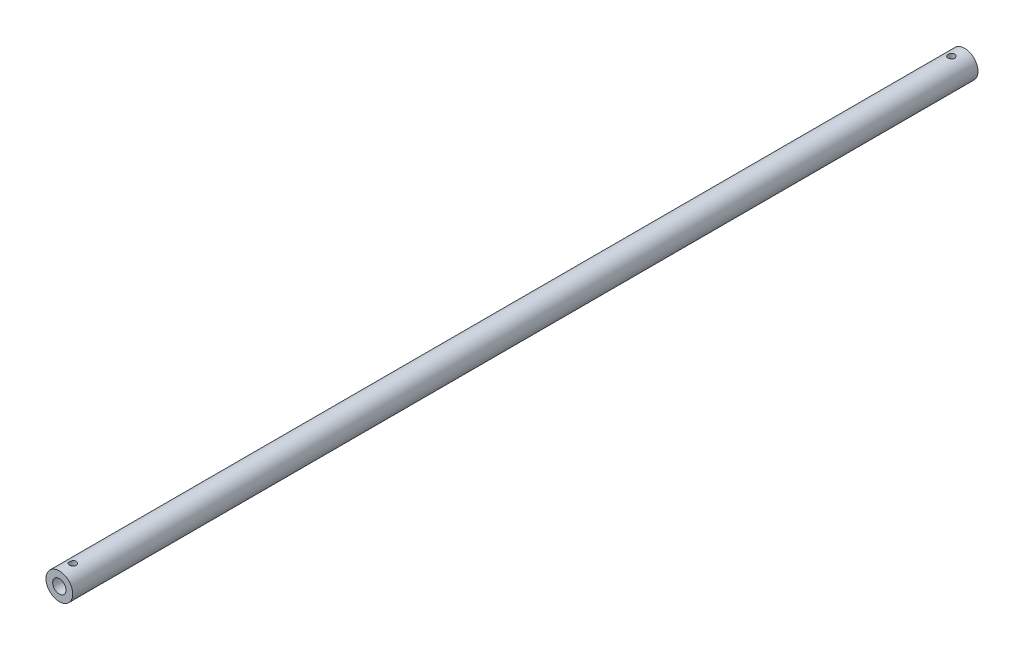
from build123d import *

# Parameters (mm, degrees)
SKETCH1_R               = 10
SKETCH1_R_2             = 5
BOSS_EXTRUDE1_DEPTH     = 338.5
CUT_EXTRUDE1_DEPTH      = 339.795292175
CUT_EXTRUDE1_DEPTH_BACK = 339.795292175
SKETCH2_R               = 2.5


with BuildPart() as part:
    # Sketch1 → Boss-Extrude1 (new, symmetric)
    with BuildSketch(Plane.XY):
        Circle(SKETCH1_R)
        Circle(SKETCH1_R_2, mode=Mode.SUBTRACT)
    extrude(amount=BOSS_EXTRUDE1_DEPTH, both=True)

    # Sketch2 → Cut-Extrude1 (cut, two sides: drawn at the far end of the back side and taken through both)
    with BuildSketch(Plane(origin=(0, 0, 0), x_dir=(1, 0, 0), z_dir=(0, 1, 0)).offset(-CUT_EXTRUDE1_DEPTH_BACK)):
        with Locations(Location((0, -328.5, 0), (0, 0, 270))):
            Circle(SKETCH2_R)
        with Locations(Location((0, 328.5, 0), (0, 0, 270))):
            Circle(SKETCH2_R)
    extrude(amount=CUT_EXTRUDE1_DEPTH + CUT_EXTRUDE1_DEPTH_BACK, mode=Mode.SUBTRACT)


solid = part.part
